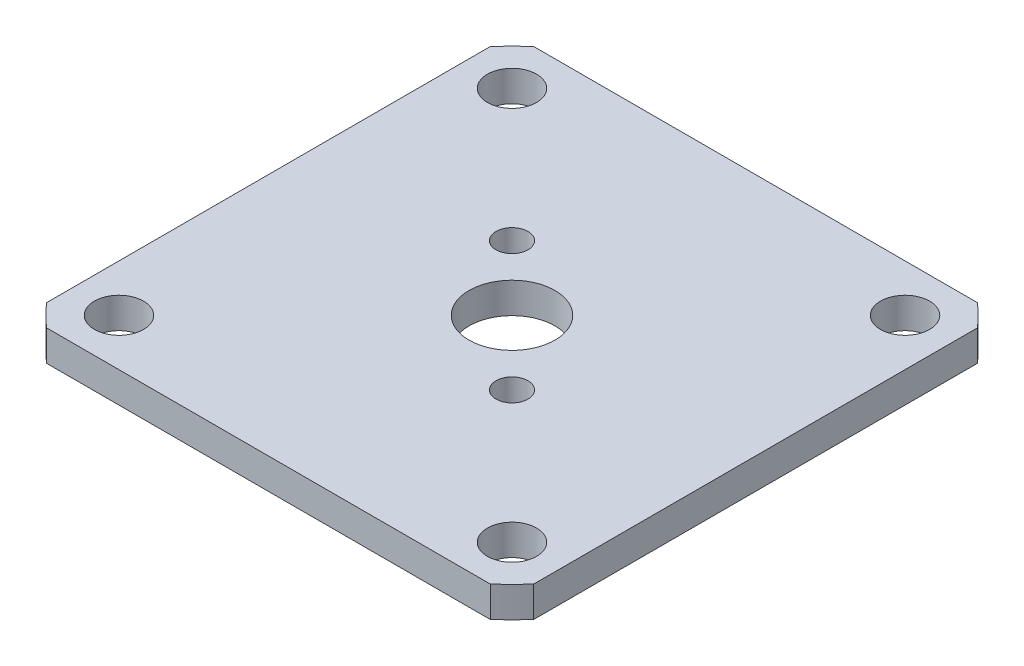
from build123d import *

# Parameters (mm, degrees)
SKETCH1_R           = 26.83
SKETCH1_R_2         = 3.5
SKETCH1_R_3         = 2
BOSS_EXTRUDE1_DEPTH = 2.5
CUT_EXTRUDE2_START  = -10
CUT_EXTRUDE2_DEPTH  = 10
SKETCH2_R           = 1.3
CUT_EXTRUDE3_DEPTH  = 10


with BuildPart() as part:
    # Sketch1 → Boss-Extrude1 (new body)
    with BuildSketch(Plane(origin=(0, 0, 0), x_dir=(1, 0, 0), z_dir=(0, 1, 0))):
        with Locations(Location((0, 0, 0), (0, 0, 270))):
            Circle(SKETCH1_R)
        with Locations(Location((0, 0, 0), (0, 0, 270))):
            Circle(SKETCH1_R_2, mode=Mode.SUBTRACT)
        with Locations(Location((-16.000000001, 16.000000001, 0), (0, 0, 270))):
            Circle(SKETCH1_R_3, mode=Mode.SUBTRACT)
        with Locations(Location((16.000000001, 16.000000001, 0), (0, 0, 270))):
            Circle(SKETCH1_R_3, mode=Mode.SUBTRACT)
        with Locations(Location((16.000000001, -16.000000001, 0), (0, 0, 270))):
            Circle(SKETCH1_R_3, mode=Mode.SUBTRACT)
        with Locations(Location((-16.000000001, -16.000000001, 0), (0, 0, 270))):
            Circle(SKETCH1_R_3, mode=Mode.SUBTRACT)
    extrude(amount=BOSS_EXTRUDE1_DEPTH)

    # Sketch3 → Cut-Extrude2 (cut)
    with BuildSketch(Plane(origin=(0, 2.5, 0), x_dir=(1, 0, 0), z_dir=(0, 1, 0)).offset(CUT_EXTRUDE2_START)):
        with BuildLine():
            Line((-19.833935995, -18.068311569), (-19.833935995, 18.068311569))
            ThreePointArc((-19.833935995, 18.068311569), (-26.83, 0), (-19.833935995, -18.068311569))
        make_face()
        with BuildLine():
            Line((-18.068311569, 19.833935995), (18.068311569, 19.833935995))
            ThreePointArc((18.068311569, 19.833935995), (0, 26.83), (-18.068311569, 19.833935995))
        make_face()
        with BuildLine():
            ThreePointArc((26.83, 0), (25.019926086, 9.687734443), (19.833935995, 18.068311569))
            Line((19.833935995, 18.068311569), (19.833935995, -18.068311569))
            ThreePointArc((19.833935995, -18.068311569), (25.019926086, -9.687734443), (26.83, 0))
        make_face()
        with BuildLine():
            ThreePointArc((-18.068311569, -19.833935995), (0, -26.83), (18.068311569, -19.833935995))
            Line((18.068311569, -19.833935995), (-18.068311569, -19.833935995))
        make_face()
    extrude(amount=CUT_EXTRUDE2_DEPTH, mode=Mode.SUBTRACT)

    # Sketch2 → Cut-Extrude3 (cut)
    with BuildSketch(Plane(origin=(0, 2.5, 0), x_dir=(1, 0, 0), z_dir=(0, 1, 0))):
        with Locations(Location((-5.262430087, 5.262430087, 0), (0, 0, 270))):
            Circle(SKETCH2_R)
        with Locations(Location((5.262430087, -5.262430087, 0), (0, 0, 270))):
            Circle(SKETCH2_R)
    extrude(amount=-CUT_EXTRUDE3_DEPTH, mode=Mode.SUBTRACT)


solid = part.part
